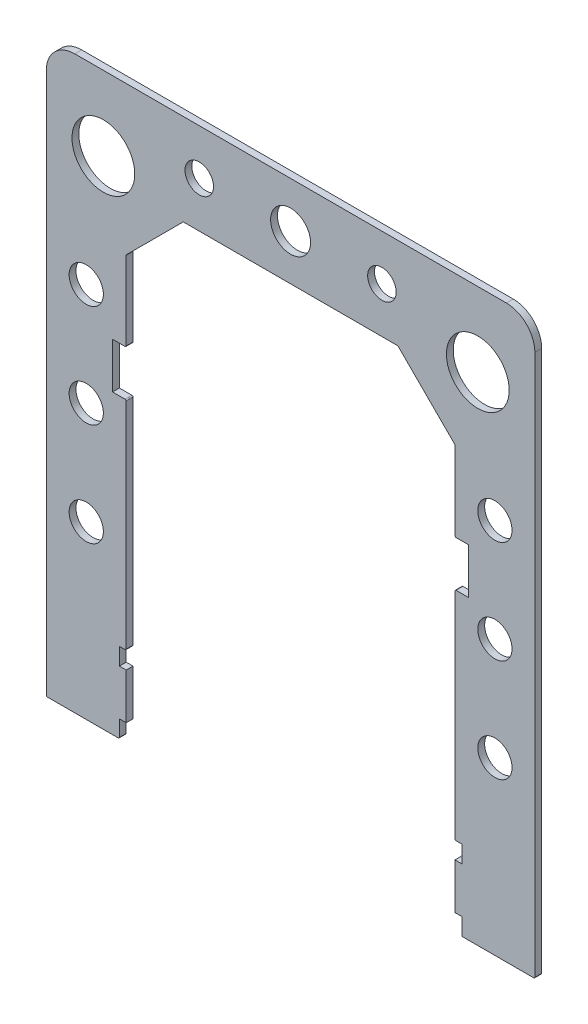
from build123d import *

# Parameters (mm, degrees)
TOWER_DEPTH = 6
SKETCH2_W   = 6
SKETCH2_H   = 15
SKETCH2_W_2 = 12
SKETCH2_H_2 = 40
MOUNT_DEPTH = 615.979674461
FILLET_2_R  = 1
SKETCH3_R   = 12.5
SKETCH3_R_2 = 17.5
SKETCH3_R_3 = 27.5
SKETCH3_R_4 = 15
LITE_DEPTH  = 615.979674461
FILLET2_R   = 25


with BuildPart() as part:
    # Sketch1 → tower (new body)
    with BuildSketch(Plane.XY):
        Polygon((0, 0), (-70, 0), (-70, 500), (358, 500), (358, 0), (288, 0), (288, 370), (238, 420), (50, 420), (0, 370), align=None)
    extrude(amount=-TOWER_DEPTH)

    # Sketch2 → mount (cut, through all)
    with BuildSketch(Plane.XY):
        with Locations((-3, 62.5)):
            Rectangle(SKETCH2_W, SKETCH2_H)
        with Locations((-3, 7.5)):
            Rectangle(SKETCH2_W, SKETCH2_H)
        with Locations((291, 7.5)):
            Rectangle(SKETCH2_W, SKETCH2_H)
        with Locations((291, 62.5)):
            Rectangle(SKETCH2_W, SKETCH2_H)
        with Locations((-6, 280)):
            Rectangle(SKETCH2_W_2, SKETCH2_H_2)
        with Locations((294, 280)):
            Rectangle(SKETCH2_W_2, SKETCH2_H_2)
    extrude(amount=-MOUNT_DEPTH, mode=Mode.SUBTRACT)

    # fillet 2
    fillet_2_edges = [part.edges().sort_by_distance(p)[0] for p in [
        (288, 300, -3),
        (288, 260, -3),
        (-70, 0, -3),
        (358, 0, -3),
        (288, 370, -3),
        (238, 420, -3),
        (50, 420, -3),
        (0, 370, -3),
        (0, 70, -3),
        (-6, 0, -3),
        (288, 70, -3),
        (294, 0, -3),
        (0, 260, -3),
        (0, 300, -3),
    ]]
    fillet(fillet_2_edges, radius=FILLET_2_R)

    # Sketch3 → lite (cut, through all)
    with BuildSketch(Plane.XY):
        with Locations((64, 460)):
            Circle(SKETCH3_R)
        with Locations((144, 460)):
            Circle(SKETCH3_R_2)
        with Locations((224, 460)):
            Circle(SKETCH3_R)
        with Locations((-20, 435)):
            Circle(SKETCH3_R_3)
        with Locations((308, 435)):
            Circle(SKETCH3_R_3)
        with Locations((-35, 330)):
            Circle(SKETCH3_R_4)
        with Locations((-35, 240)):
            Circle(SKETCH3_R_4)
        with Locations((-35, 150)):
            Circle(SKETCH3_R_4)
        with Locations((323, 330)):
            Circle(SKETCH3_R_4)
        with Locations((323, 240)):
            Circle(SKETCH3_R_4)
        with Locations((323, 150)):
            Circle(SKETCH3_R_4)
    extrude(amount=-LITE_DEPTH, mode=Mode.SUBTRACT)

    # fillet2
    fillet2_edges = [part.edges().sort_by_distance(p)[0] for p in [
        (-70, 500, -3),
        (358, 500, -3),
    ]]
    fillet(fillet2_edges, radius=FILLET2_R)


solid = part.part
